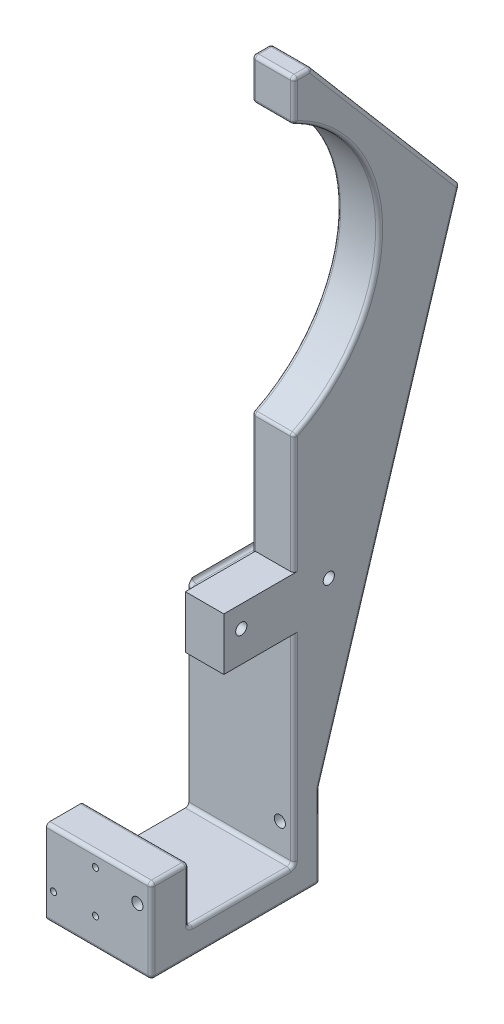
from build123d import *

# Parameters (mm, degrees)
SKETCH3_W                       = 55.92
SKETCH3_H                       = 48.2
BOSS_EXTRUDE1_DEPTH             = 8
BOSS_EXTRUDE2_DEPTH             = 95
SKETCH5_R                       = 2.75
SKETCH5_W                       = 40.7
SKETCH5_H                       = 64.8
CUT_EXTRUDE1_DEPTH              = 124.599095466
BOSS_EXTRUDE4_DEPTH             = 55.92
SKETCH9_R                       = 42.5
CUT_EXTRUDE2_DEPTH              = 229.287727222
SKETCH10_W                      = 18
SKETCH10_H                      = 140
SKETCH10_W_2                    = 13.92
SKETCH10_H_2                    = 100
CUT_EXTRUDE3_DEPTH              = 216.852487593
SKETCH11_W                      = 48.42
SKETCH11_H                      = 10.7
BOSS_EXTRUDE5_DEPTH             = 16
SKETCH12_R                      = 0.875
CUT_EXTRUDE7_DEPTH              = 8
CUT_EXTRUDE8_START              = -43.2
SKETCH12_3_R                    = 0.875
CUT_EXTRUDE8_DEPTH              = 5
FILLET3_R                       = 1
CUT_EXTRUDE9_REACH              = 218.008
SKETCH14_R                      = 1.6
SKETCH15_W                      = 11
SKETCH15_H                      = 15
BOSS_EXTRUDE6_DEPTH             = 20
BOSS_EXTRUDE6_DIRECTION_2_REACH = 217.827
CUT_EXTRUDE10_REACH             = 230.242
SKETCH16_R                      = 1.6
CUT_EXTRUDE13_DEPTH             = 216.826567209
CUT_EXTRUDE13_DEPTH_BACK        = 216.826567209
SKETCH17_W                      = 258.17245833
SKETCH17_H                      = 778.313168381
CUT_EXTRUDE14_DEPTH             = 15


with BuildPart() as part:
    # Sketch3 → Boss-Extrude1 (new body)
    with BuildSketch(Plane(origin=(0, 0, 0), x_dir=(1, 0, 0), z_dir=(0, 1, 0))):
        with Locations((-27.96, 24.1)):
            Rectangle(SKETCH3_W, SKETCH3_H)
    extrude(amount=BOSS_EXTRUDE1_DEPTH)

    # Sketch4 → Boss-Extrude2 (add)
    with BuildSketch(Plane(origin=(0, 8, 0), x_dir=(1, 0, 0), z_dir=(0, 1, 0))):
        Polygon((-55.92, 0), (-55.92, 48.2), (0, 48.2), (0, 40.7), (-48.42, 40.7), (-48.42, 0), align=None)
    extrude(amount=BOSS_EXTRUDE2_DEPTH)

    # Sketch5 → Cut-Extrude1 (cut, through all)
    with BuildSketch(Plane(origin=(-48.42, 0, 0), x_dir=(0, 0, -1), z_dir=(1, 0, 0))):
        with Locations((17.2, 12.5)):
            Circle(SKETCH5_R)
        with Locations((34.2, 12.5)):
            Circle(SKETCH5_R)
        with Locations(Location((34.2, 87.5, 0), (0, 0, 180))):
            Circle(SKETCH5_R)
        with Locations(Location((17.2, 87.5, 0), (0, 0, 180))):
            Circle(SKETCH5_R)
        with Locations((20.35, 50)):
            Rectangle(SKETCH5_W, SKETCH5_H)
    extrude(amount=-CUT_EXTRUDE1_DEPTH, mode=Mode.SUBTRACT)

    # Sketch8 → Boss-Extrude4 (add)
    with BuildSketch(Plane(origin=(0, 0, 0), x_dir=(0, 0, -1), z_dir=(1, 0, 0))):
        Polygon((40.7, 103), (40.7, 203), (45.7, 203), (88.2, 153), (48.2, 24), (48.2, 103), align=None)
    extrude(amount=-BOSS_EXTRUDE4_DEPTH)

    # Sketch9 → Cut-Extrude2 (cut, through all)
    with BuildSketch(Plane(origin=(0, 0, 0), x_dir=(0, 0, -1), z_dir=(1, 0, 0))):
        with Locations((22.577976258, 153)):
            Circle(SKETCH9_R)
    extrude(amount=-CUT_EXTRUDE2_DEPTH, mode=Mode.SUBTRACT)

    # Sketch10 → Cut-Extrude3 (cut, through all)
    with BuildSketch(Plane.XY.offset(-40.7)):
        with Locations((-21, 133)):
            Rectangle(SKETCH10_W, SKETCH10_H)
        with Locations((-48.96, 153)):
            Rectangle(SKETCH10_W_2, SKETCH10_H_2)
    extrude(amount=-CUT_EXTRUDE3_DEPTH, mode=Mode.SUBTRACT)

    # Sketch11 → Boss-Extrude5 (add)
    with BuildSketch(Plane(origin=(0, 8, 0), x_dir=(1, 0, 0), z_dir=(0, 1, 0))):
        with Locations((-24.21, 5.35)):
            Rectangle(SKETCH11_W, SKETCH11_H)
    extrude(amount=BOSS_EXTRUDE5_DEPTH)

    # Sketch12 → Cut-Extrude7 (cut)
    with BuildSketch(Plane.XY):
        with Locations((-39.96, 8.15)):
            Circle(SKETCH12_R)
        with Locations((-39.96, 20.15)):
            Circle(SKETCH12_R)
        with Locations((-27.96, 8.15)):
            Circle(SKETCH12_R)
        with Locations(Location((-15.96, 8.15, 0), (0, 0, 180))):
            Circle(SKETCH12_R)
        with Locations(Location((-15.96, 20.15, 0), (0, 0, 180))):
            Circle(SKETCH12_R)
    extrude(amount=-CUT_EXTRUDE7_DEPTH, mode=Mode.SUBTRACT)

    # Sketch12<3> → Cut-Extrude8 (cut)
    with BuildSketch(Plane.XY.offset(CUT_EXTRUDE8_START)):
        with Locations((-39.96, 8.15)):
            Circle(SKETCH12_3_R)
        with Locations((-39.96, 20.15)):
            Circle(SKETCH12_3_R)
        with Locations((-27.96, 8.15)):
            Circle(SKETCH12_3_R)
        with Locations(Location((-15.96, 8.15, 0), (0, 0, 180))):
            Circle(SKETCH12_3_R)
        with Locations(Location((-15.96, 20.15, 0), (0, 0, 180))):
            Circle(SKETCH12_3_R)
    extrude(amount=-CUT_EXTRUDE8_DEPTH, mode=Mode.SUBTRACT)

    # Fillet3
    fillet3_edges = [part.edges().sort_by_distance(p)[0] for p in [
        (-36, 191.442713945, -40.7),
        (-6, 191.442713945, -40.7),
        (-42, 153, -65.077976258),
        (-12, 153, -65.077976258),
        (-30, 153, -65.077976258),
        (-36, 153, -88.2),
        (-6, 153, -88.2),
        (-48.96, 103, -72.696124031),
        (-21, 63, -60.293023256),
        (-36, 203, -45.7),
        (-6, 203, -45.7),
        (-36, 203, -40.7),
        (-6, 203, -40.7),
        (-30, 178, -66.95),
        (-30, 108, -74.246511628),
        (-30, 63, -50.496511628),
        (-12, 178, -66.95),
        (-12, 108, -74.246511628),
        (-12, 203, -43.2),
        (-12, 88.778643027, -40.7),
        (-30, 88.778643027, -40.7),
        (-21, 63, -40.7),
        (-30, 197.221356973, -40.7),
        (-12, 197.221356973, -40.7),
        (-30, 203, -43.2),
        (-12, 63, -50.496511628),
        (-42, 178, -66.95),
        (-42, 128, -80.448062016),
        (-42, 203, -43.2),
        (-42, 197.221356973, -40.7),
        (-45.21, 103, -40.7),
        (-42, 108.778643027, -40.7),
        (-42, 103, -56.698062016),
        (-48.42, 17.6, -25.7),
        (-48.42, 8, -25.7),
        (0, 8, -25.7),
        (-48.42, 20.8, -10.7),
        (-24.21, 8, -10.7),
        (-48.42, 92.7, 0),
        (0, 16, -10.7),
        (-48.42, 12.8, -10.7),
        (-48.42, 20.8, 0),
        (-24.21, 8, -40.7),
        (0, 24, -5.35),
        (-24.21, 24, -10.7),
        (-48.42, 24, -5.35),
        (-24.21, 24, 0),
        (-48.42, 92.7, -40.7),
        (0, 197.221356973, -40.7),
        (-52.17, 103, 0),
        (-48.42, 103, -20.35),
        (-48.42, 12.8, -40.7),
        (-55.92, 8.8, 0),
        (-27.96, 0, -48.2),
        (-52.17, 17.6, 0),
        (-55.92, 82.4, -20.35),
        (-52.17, 82.4, 0),
        (-55.92, 50, -40.7),
        (-52.17, 82.4, -40.7),
        (-55.92, 17.6, -20.35),
        (-52.17, 17.6, -40.7),
        (-48.42, 17.6, -5.35),
        (0, 0, -24.1),
        (-48.42, 82.4, -20.35),
        (-27.96, 0, 0),
        (-55.92, 0, -24.1),
        (-55.92, 103, -36.348062016),
        (-55.92, 12, -48.2),
        (0, 12, -48.2),
        (-55.92, 63.5, -60.448062016),
        (-27.96, 24, -48.2),
        (0, 88.5, -68.2),
        (0, 178, -66.95),
        (0, 203, -43.2),
        (0, 12, 0),
        (-55.92, 92.7, 0),
        (0, 61.278643027, -40.7),
        (-6, 114.557286055, -40.7),
        (0, 153, -65.077976258),
        (-36, 114.557286055, -40.7),
    ]]
    fillet(fillet3_edges, radius=FILLET3_R)

    # Cut-Extrude9: up to this face of the body (flat: up to its plane)
    cut_extrude9_end = Plane(part.part.faces().sort_by_distance((-26.9866887, 11.661518577, 0))[0])
    # Sketch14 → Cut-Extrude9 (cut, up to the picked face)
    with BuildSketch(Plane(origin=(0, 0, -48.2), x_dir=(-1, 0, 0), z_dir=(0, 0, -1)), mode=Mode.PRIVATE) as cut_extrude9_sk1:
        with Locations((4, 17.228518844)):
            Circle(SKETCH14_R)
    cut_extrude9_tool1 = split(extrude(cut_extrude9_sk1.sketch, amount=-CUT_EXTRUDE9_REACH, mode=Mode.PRIVATE), bisect_by=cut_extrude9_end, keep=Keep.BOTH, mode=Mode.PRIVATE)
    add(cut_extrude9_tool1.solids().sort_by(Axis((-4, 17.228519, -48.2), (0, 0, 1)))[0], mode=Mode.SUBTRACT)

    # Sketch15 → Boss-Extrude6 (add)
    with BuildSketch(Plane.XY.offset(-40.7)):
        with Locations((-5.5, 73)):
            Rectangle(SKETCH15_W, SKETCH15_H)
    extrude(amount=BOSS_EXTRUDE6_DEPTH)

    # Sketch15 → Boss-Extrude6 direction 2 (add, up to next)
    with BuildSketch(Plane.XY.offset(-40.7), mode=Mode.PRIVATE) as boss_extrude6_direction_2_sk1:
        with Locations((-5.5, 73)):
            Rectangle(SKETCH15_W, SKETCH15_H)
    boss_extrude6_direction_2_tool1 = extrude(boss_extrude6_direction_2_sk1.sketch, amount=-BOSS_EXTRUDE6_DIRECTION_2_REACH, mode=Mode.PRIVATE) - part.part
    add(boss_extrude6_direction_2_tool1.solids().sort_by_distance((-5.5, 73, -40.7))[0])

    # Sketch16 → Cut-Extrude10 (cut, up to next)
    with BuildSketch(Plane(origin=(0, 0, 0), x_dir=(0, 0, -1), z_dir=(1, 0, 0)), mode=Mode.PRIVATE) as cut_extrude10_sk1:
        with Locations((25.69, 74.3258878)):
            Circle(SKETCH16_R)
    cut_extrude10_tool1 = extrude(cut_extrude10_sk1.sketch, amount=-CUT_EXTRUDE10_REACH, mode=Mode.PRIVATE) & part.part
    # Sketch16 → Cut-Extrude10 (cut, up to next)
    with BuildSketch(Plane(origin=(0, 0, 0), x_dir=(0, 0, -1), z_dir=(1, 0, 0)), mode=Mode.PRIVATE) as cut_extrude10_sk2:
        with Locations((50.69, 74.3258878)):
            Circle(SKETCH16_R)
    cut_extrude10_tool2 = extrude(cut_extrude10_sk2.sketch, amount=-CUT_EXTRUDE10_REACH, mode=Mode.PRIVATE) & part.part
    add(cut_extrude10_tool1.solids().sort_by_distance((0, 74.325888, -25.69))[0], mode=Mode.SUBTRACT)
    add(cut_extrude10_tool2.solids().sort_by_distance((0, 74.325888, -50.69))[0], mode=Mode.SUBTRACT)

    # Sketch17 → Cut-Extrude13 (cut, two sides: drawn at the far end of the back side and taken through both)
    with BuildSketch(Plane.XY.offset(-40.7).offset(-CUT_EXTRUDE13_DEPTH_BACK)):
        with Locations((-159.086229165, 140.248603605)):
            Rectangle(SKETCH17_W, SKETCH17_H)
    extrude(amount=CUT_EXTRUDE13_DEPTH + CUT_EXTRUDE13_DEPTH_BACK, mode=Mode.SUBTRACT)

    # Sketch21 → Cut-Extrude14 (cut)
    with BuildSketch(Plane(origin=(-30, 0, 0), x_dir=(0, 0, -1), z_dir=(1, 0, 0))):
        Polygon((45.7, 50), (48.2, 54.330127019), (50.7, 50), align=None)
        Polygon((43.2, 35), (48.2, 35), (45.7, 30.669872981), align=None)
        Polygon((45.7, 2.5), (40.7, 2.5), (43.2, 6.830127019), align=None)
        Polygon((2.85, 20.5), (7.85, 20.5), (5.35, 16.169872981), align=None)
        Polygon((10, 2.5), (5, 2.5), (7.5, 6.830127019), align=None)
    extrude(amount=CUT_EXTRUDE14_DEPTH, mode=Mode.SUBTRACT)


solid = part.part
